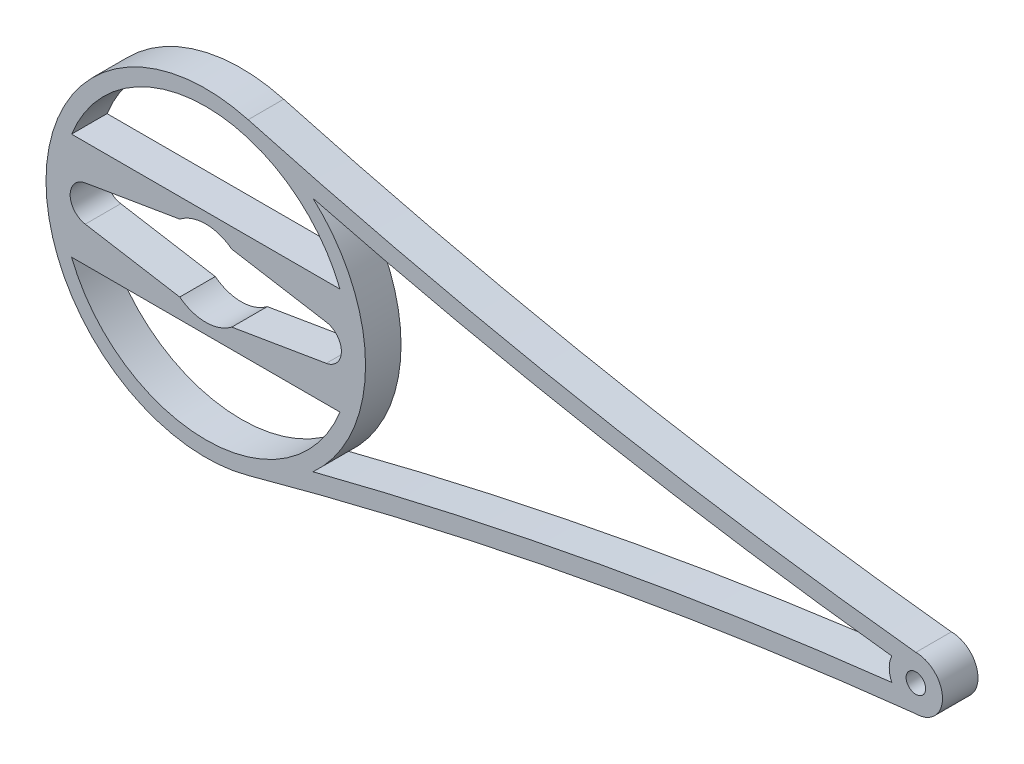
from build123d import *

# Parameters (mm, degrees)
BOSS_EXTRUDE1_DEPTH     = 2.5
CUT_EXTRUDE1_DEPTH      = 107.279407695
CUT_EXTRUDE2_DEPTH      = 107.191160178
CUT_EXTRUDE2_DEPTH_BACK = 107.191160178
SKETCH6_R               = 1.375


with BuildPart() as part:
    # Sketch3 → Boss-Extrude1 (new, symmetric)
    with BuildSketch(Plane.XY):
        with BuildLine():
            ThreePointArc((5.967243679, 21.694285028), (-22.5, 0), (5.967243679, -21.694285028))
            ThreePointArc((5.967243679, -21.694285028), (52.625175797, -10.843791309), (100, -3.75))
            ThreePointArc((100, -3.75), (103.75, 0), (100, 3.75))
            ThreePointArc((100, 3.75), (52.625175797, 10.843791309), (5.967243679, 21.694285028))
        make_face()
        with BuildLine():
            Line((-18.9, -7.5), (18.9, -7.5))
            ThreePointArc((18.9, -7.5), (0, -20.333715843), (-18.9, -7.5))
        make_face(mode=Mode.SUBTRACT)
        with BuildLine():
            Line((-18.9, 7.5), (18.9, 7.5))
            ThreePointArc((18.9, 7.5), (0, 20.333715843), (-18.9, 7.5))
        make_face(mode=Mode.SUBTRACT)
        with BuildLine():
            ThreePointArc((15.104191038, 16.676732686), (55.600003106, 7.741362472), (96.614544634, 1.612821119))
            ThreePointArc((96.614544634, 1.612821119), (96.25, 0), (96.614544634, -1.612821119))
            ThreePointArc((96.614544634, -1.612821119), (55.600003106, -7.741362472), (15.104191038, -16.676732686))
            ThreePointArc((15.104191038, -16.676732686), (22.5, 0), (15.104191038, 16.676732686))
        make_face(mode=Mode.SUBTRACT)
    extrude(amount=BOSS_EXTRUDE1_DEPTH, both=True)

    # Sketch4 → Cut-Extrude1 (cut, through all)
    with BuildSketch(Plane.XY.offset(2.5)):
        with BuildLine():
            Line((-16.97242536, 2.514767746), (-3.665719575, 4.75))
            ThreePointArc((-3.665719575, 4.75), (0, 6), (3.665719575, 4.75))
            Line((3.665719575, 4.75), (16.97242536, 2.514767746))
            ThreePointArc((16.97242536, 2.514767746), (19.1, 0), (16.97242536, -2.514767746))
            Line((16.97242536, -2.514767746), (3.665719575, -4.75))
            ThreePointArc((3.665719575, -4.75), (0, -6), (-3.665719575, -4.75))
            Line((-3.665719575, -4.75), (-16.97242536, -2.514767746))
            ThreePointArc((-16.97242536, -2.514767746), (-19.1, 0), (-16.97242536, 2.514767746))
        make_face()
    extrude(amount=-CUT_EXTRUDE1_DEPTH, mode=Mode.SUBTRACT)

    # Sketch6 → Cut-Extrude2 (cut, two sides: drawn at the far end of the back side and taken through both)
    with BuildSketch(Plane.XY.offset(-CUT_EXTRUDE2_DEPTH_BACK)):
        with Locations((100, 0)):
            Circle(SKETCH6_R)
    extrude(amount=CUT_EXTRUDE2_DEPTH + CUT_EXTRUDE2_DEPTH_BACK, mode=Mode.SUBTRACT)


solid = part.part
